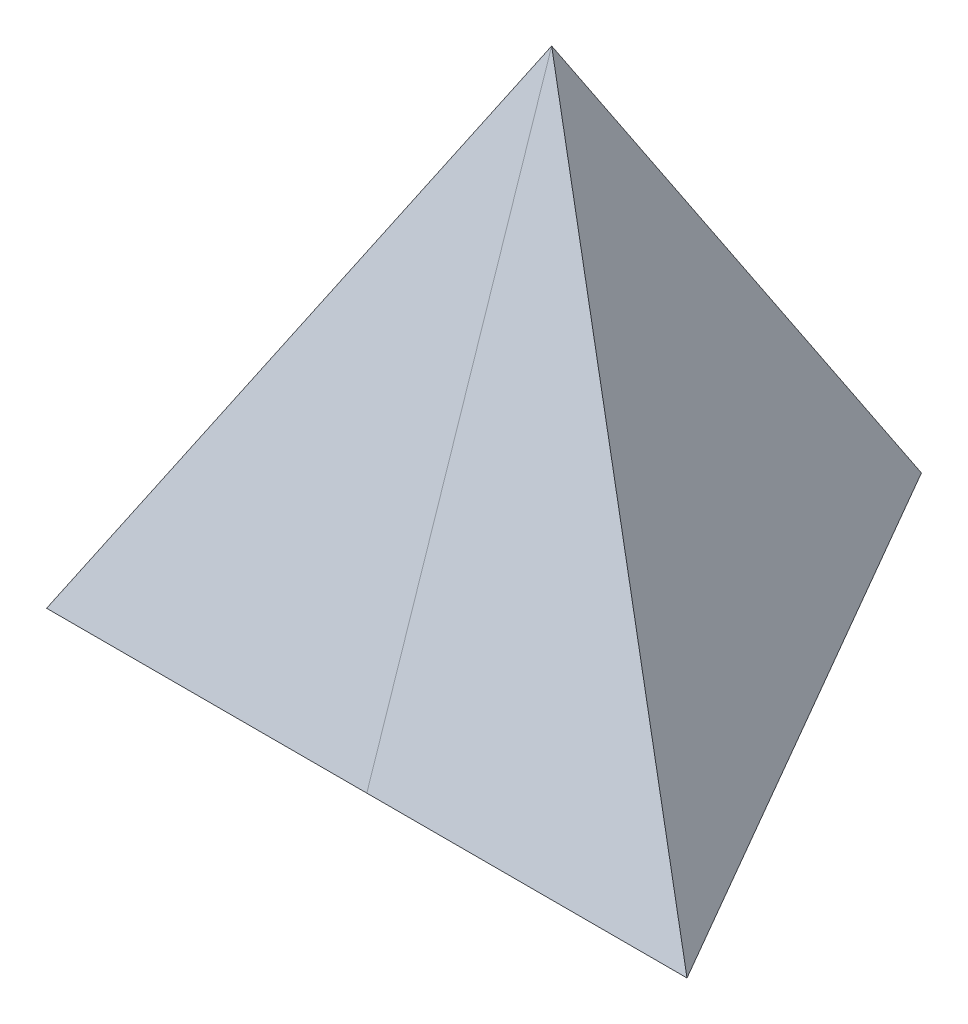
from build123d import *


with BuildPart() as part:
    # Sketch1 → Loft1 section 0
    with BuildSketch(Plane(origin=(0, 0, 0), x_dir=(1, 0, 0), z_dir=(0, 1, 0)), mode=Mode.PRIVATE) as loft1_s0:
        with BuildLine():
            Line((0, 33.866666667), (0, -16.933333333))
            Line((0, -16.933333333), (-29.329393675, -16.933333333))
            Line((-29.329393675, -16.933333333), (0, 33.866666667))
        make_face()
    loft([loft1_s0.sketch, Vertex(0, 50.8, 0)])


with BuildPart() as body_2:
    # Sketch3 → Loft2 section 0
    with BuildSketch(Plane(origin=(0, 0, 0), x_dir=(1, 0, 0), z_dir=(0, 1, 0)), mode=Mode.PRIVATE) as loft2_s0:
        with BuildLine():
            Line((0, 33.866666667), (0, -16.933333333))
            Line((0, -16.933333333), (29.329393675, -16.933333333))
            Line((29.329393675, -16.933333333), (0, 33.866666667))
        make_face()
    loft([loft2_s0.sketch, Vertex(0, 50.8, 0)])


solid = Compound([part.part, body_2.part])
